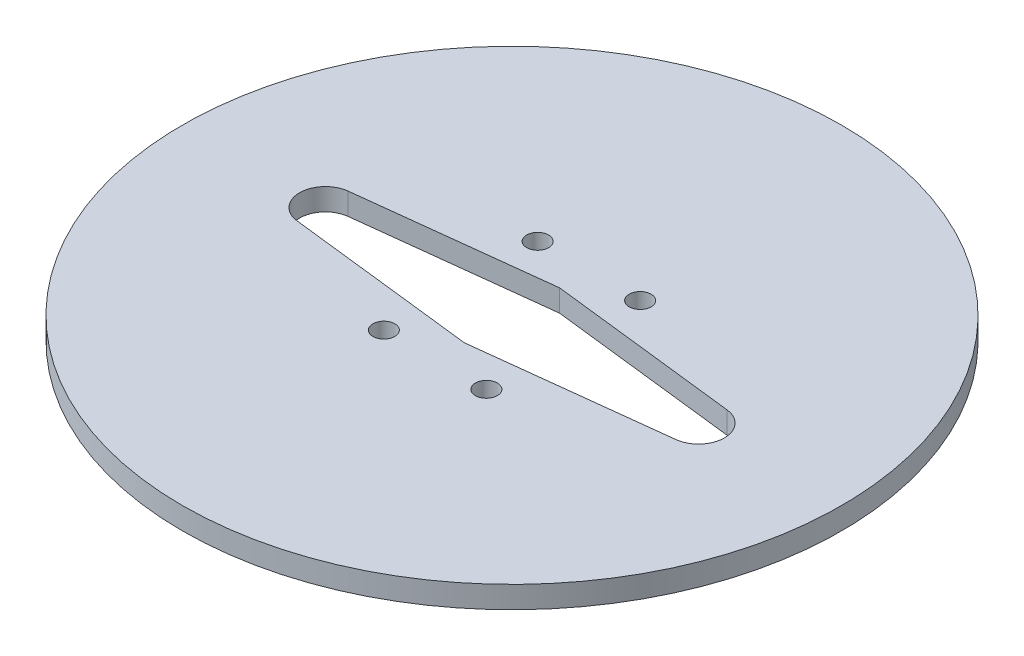
from build123d import *

# Parameters (mm, degrees)
SKETCH1_R           = 45
BOSS_EXTRUDE1_DEPTH = 3
CUT_EXTRUDE1_DEPTH  = 3
SKETCH4_R           = 1.5
CUT_EXTRUDE2_DEPTH  = 3


with BuildPart() as part:
    # Sketch1 → Boss-Extrude1 (new body)
    with BuildSketch(Plane(origin=(0, 0, 0), x_dir=(1, 0, 0), z_dir=(0, 1, 0))):
        with Locations(Location((0, 0, 0), (0, 0, 270))):
            Circle(SKETCH1_R)
    extrude(amount=BOSS_EXTRUDE1_DEPTH)

    # Sketch3 → Cut-Extrude1 (cut)
    with BuildSketch(Plane(origin=(0, 3, 0), x_dir=(1, 0, 0), z_dir=(0, 1, 0))):
        with BuildLine():
            Line((-25.882250574, 3.5), (0, 6.5))
            Line((0, 6.5), (25.882250574, 3.5))
            ThreePointArc((25.882250574, 3.5), (29, 0), (25.882250574, -3.5))
            Line((25.882250574, -3.5), (0, -6.5))
            Line((0, -6.5), (-25.882250574, -3.5))
            ThreePointArc((-25.882250574, -3.5), (-29, 0), (-25.882250574, 3.5))
        make_face()
    extrude(amount=-CUT_EXTRUDE1_DEPTH, mode=Mode.SUBTRACT)

    # Sketch4 → Cut-Extrude2 (cut)
    with BuildSketch(Plane(origin=(0, 3, 0), x_dir=(1, 0, 0), z_dir=(0, 1, 0))):
        with Locations(Location((-7, -10.5, 0), (0, 0, 270))):
            Circle(SKETCH4_R)
        with Locations(Location((7, -10.5, 0), (0, 0, 270))):
            Circle(SKETCH4_R)
        with Locations(Location((-7, 10.5, 0), (0, 0, 270))):
            Circle(SKETCH4_R)
        with Locations(Location((7, 10.5, 0), (0, 0, 270))):
            Circle(SKETCH4_R)
    extrude(amount=-CUT_EXTRUDE2_DEPTH, mode=Mode.SUBTRACT)


solid = part.part
